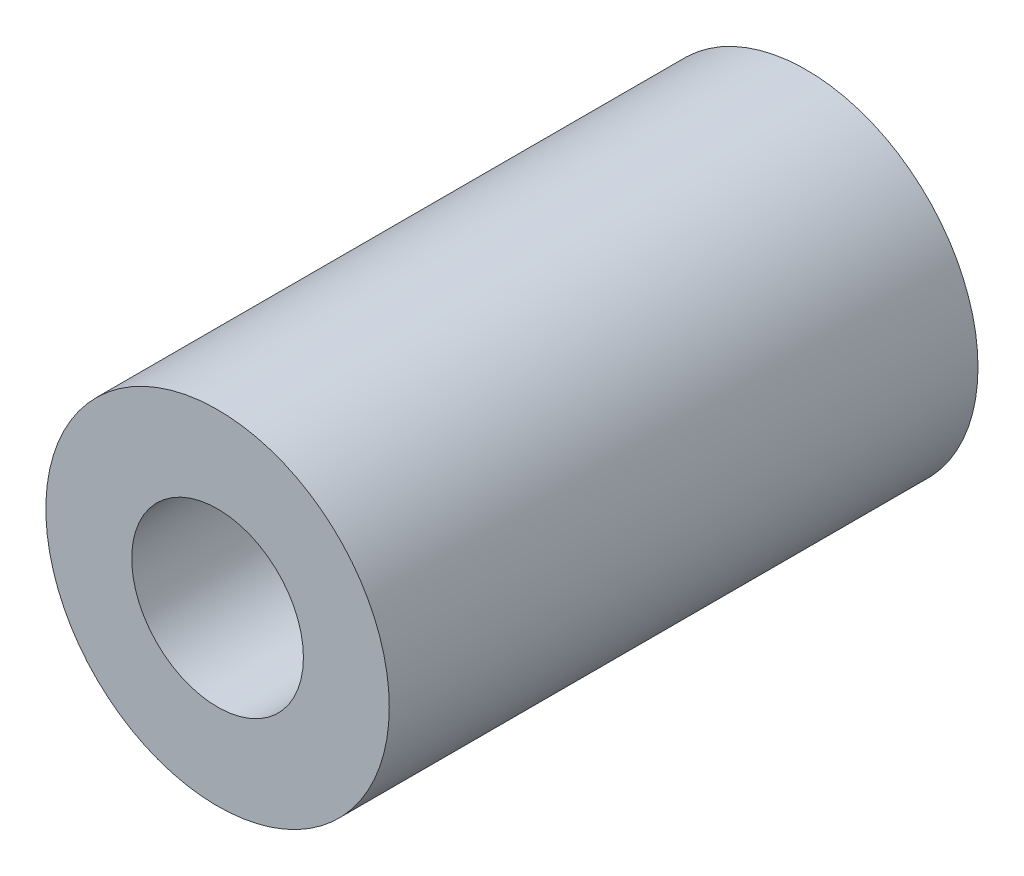
from build123d import *

# Parameters (mm, degrees)
SKETCH_1_R      = 3.5
SKETCH_1_R_2    = 1.75
EXTRUDE_1_DEPTH = 12


with BuildPart() as part:
    # 草图1 → 凸台-拉伸1 (new body)
    with BuildSketch(Plane.XY):
        Circle(SKETCH_1_R)
        Circle(SKETCH_1_R_2, mode=Mode.SUBTRACT)
    extrude(amount=EXTRUDE_1_DEPTH)


solid = part.part
